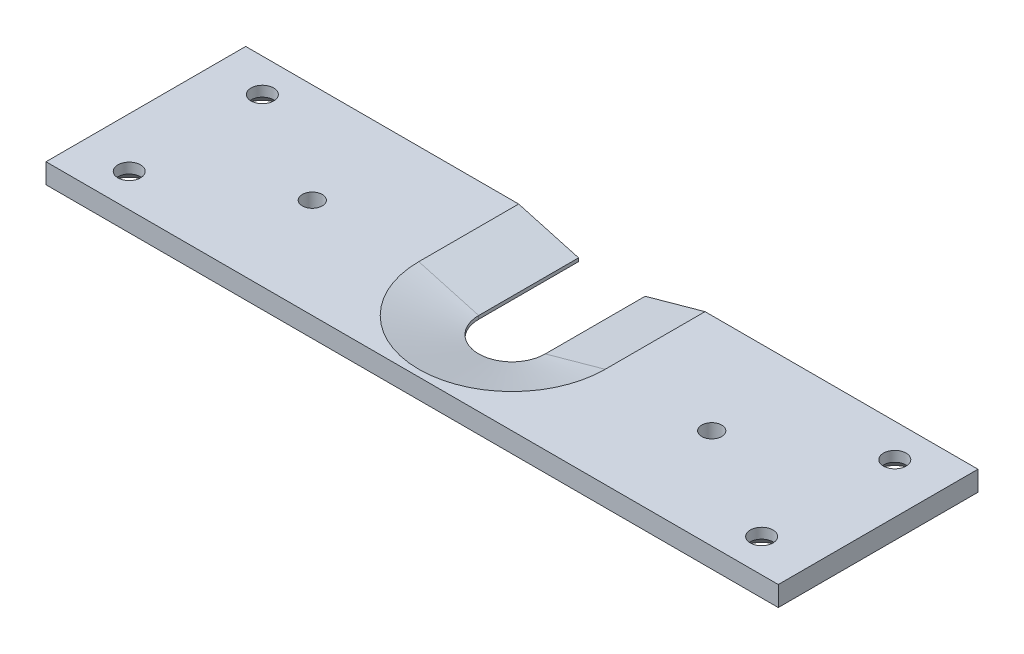
from build123d import *

# Parameters (mm, degrees)
SKETCH1_W                                    = 110
SKETCH1_H                                    = 30
EXTRUDE1_DEPTH                               = 3
CUT_EXTRUDE1_DEPTH                           = 58.087651905
CHAMFER1_SIZE                                = 9
CHAMFER1_SIZE2                               = 2.5
CSK_FOR_M3_COUNTERSUNK_RAISED_HEAD_S_2_COUNT = 2
CSK_FOR_M3_COUNTERSUNK_RAISED_HEAD_S_2_PITCH = 95
CSK_FOR_M3_COUNTERSUNK_RAISED_HEAD_S_3_COUNT = 2
CSK_FOR_M3_COUNTERSUNK_RAISED_HEAD_S_3_PITCH = 97.082439195
CSK_FOR_M3_COUNTERSUNK_RAISED_HEAD_S_4_COUNT = 2
CSK_FOR_M3_COUNTERSUNK_RAISED_HEAD_S_4_PITCH = 20
M3_TAPPED_HOLE1_D                            = 3


with BuildPart() as part:
    # Sketch1 → Extrude1 (new body)
    with BuildSketch(Plane(origin=(0, 0, 0), x_dir=(1, 0, 0), z_dir=(0, 1, 0))):
        Rectangle(SKETCH1_W, SKETCH1_H)
    extrude(amount=EXTRUDE1_DEPTH)

    # Sketch2 → Cut-Extrude1 (cut, through all)
    with BuildSketch(Plane(origin=(0, 3, 0), x_dir=(-1, 0, 0), z_dir=(0, 1, 0))):
        with BuildLine():
            Line((5, 0), (5, -15))
            Line((5, -15), (-5, -15))
            Line((-5, -15), (-5, 0))
            ThreePointArc((-5, 0), (0, 5), (5, 0))
        make_face()
    extrude(amount=-CUT_EXTRUDE1_DEPTH, mode=Mode.SUBTRACT)

    # Chamfer1
    chamfer1_edges = [part.edges().sort_by_distance(p)[0] for p in [
        (0, 3, 5),
        (5, 3, -7.5),
        (-5, 3, -7.5),
    ]]
    chamfer1_side = [part.faces().sort_by_distance(p)[0] for p in [
        (-53.859824575, 3, 0),
    ]]
    chamfer(chamfer1_edges, length=CHAMFER1_SIZE, length2=CHAMFER1_SIZE2, reference=chamfer1_side[0])

    # Sketch8 → CSK for M3 Countersunk Raised Head Screw1 (revolve, cut)
    with BuildSketch(Plane(origin=(47.5, 0, -10), x_dir=(0, 0, -1), z_dir=(1, 0, 0))):
        Polygon((0, 0), (0, 3), (1.7, 3), (1.7, 1.45), (3.15, 0), align=None)
    csk_for_m3_countersunk_raised_head_screw = revolve(axis=Axis((47.5, -6.35, -10), (0, 1, 0)), mode=Mode.SUBTRACT)

    # CSK for M3 Countersunk Raised Head S 2: CSK for M3 Countersunk Raised Head Screw1 ×2
    with Locations(*[(-i * CSK_FOR_M3_COUNTERSUNK_RAISED_HEAD_S_2_PITCH, 0, 0) for i in range(1, CSK_FOR_M3_COUNTERSUNK_RAISED_HEAD_S_2_COUNT)]):
        add(csk_for_m3_countersunk_raised_head_screw, mode=Mode.SUBTRACT)

    # CSK for M3 Countersunk Raised Head S 3: CSK for M3 Countersunk Raised Head Screw1 ×2
    with Locations(*[Vector(-0.978549784986749, 0, 0.20601048104984188) * (i * CSK_FOR_M3_COUNTERSUNK_RAISED_HEAD_S_3_PITCH) for i in range(1, CSK_FOR_M3_COUNTERSUNK_RAISED_HEAD_S_3_COUNT)]):
        add(csk_for_m3_countersunk_raised_head_screw, mode=Mode.SUBTRACT)

    # CSK for M3 Countersunk Raised Head S 4: CSK for M3 Countersunk Raised Head Screw1 ×2
    with Locations(*[(0, 0, i * CSK_FOR_M3_COUNTERSUNK_RAISED_HEAD_S_4_PITCH) for i in range(1, CSK_FOR_M3_COUNTERSUNK_RAISED_HEAD_S_4_COUNT)]):
        add(csk_for_m3_countersunk_raised_head_screw, mode=Mode.SUBTRACT)

    # M3 Tapped Hole1 (through all)
    with Locations(Plane(origin=(0, 3, 0), x_dir=(-1, 0, 0), z_dir=(0, 1, 0))):
        with Locations((-30, 0), (30, 0)):
            Hole(M3_TAPPED_HOLE1_D / 2)


solid = part.part
